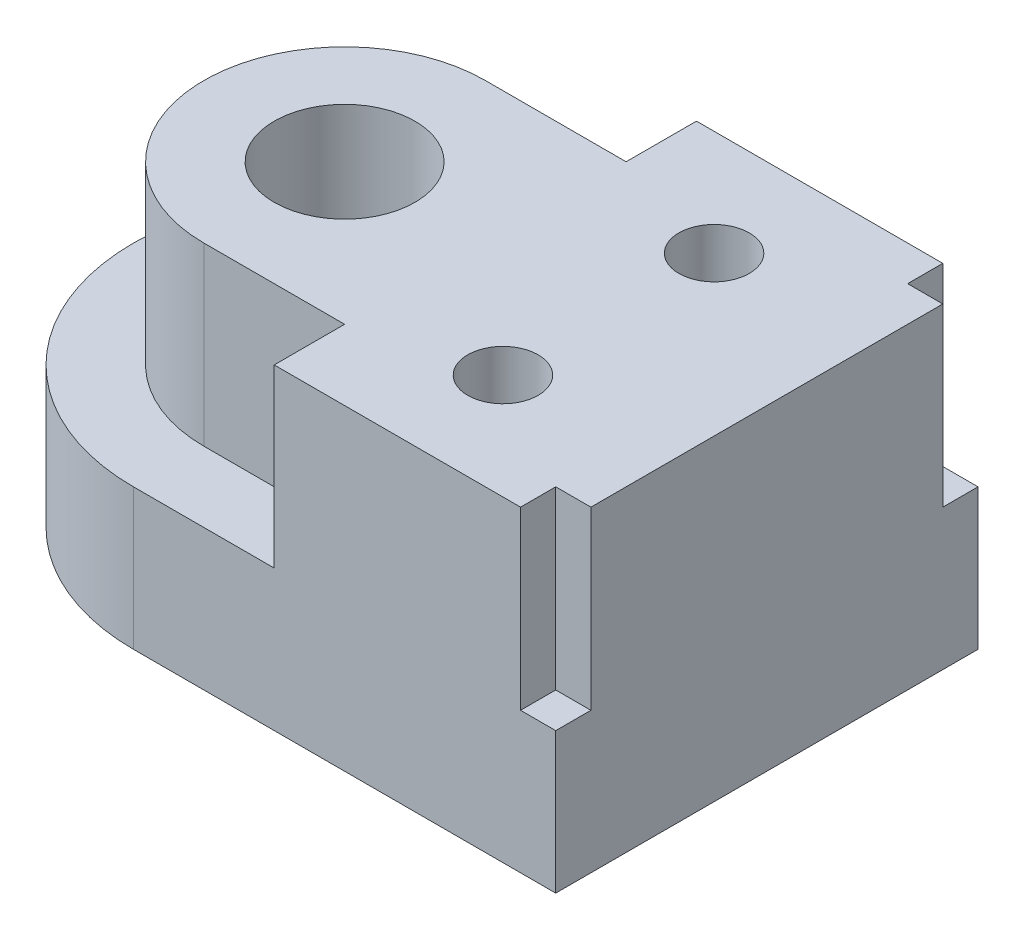
from build123d import *

# Parameters (mm, degrees)
BOSS_EXTRUDE2_DEPTH = 45
BOSS_EXTRUDE3_DEPTH = 20
SKETCH3_W           = 5
SKETCH3_H           = 5
CUT_EXTRUDE1_DEPTH  = 25
SKETCH4_R           = 10
SKETCH4_R_2         = 5
CUT_EXTRUDE2_DEPTH  = 81.777472107


with BuildPart() as part:
    # Sketch1 → Boss-Extrude2 (new body)
    with BuildSketch(Plane(origin=(0, 0, 0), x_dir=(1, 0, 0), z_dir=(0, 1, 0))):
        with BuildLine():
            Line((60, 30), (20, 30))
            Line((20, 30), (20, 20))
            Line((20, 20), (0, 20))
            ThreePointArc((0, 20), (-20, 0), (0, -20))
            Line((0, -20), (20, -20))
            Line((20, -20), (20, -30))
            Line((20, -30), (60, -30))
            Line((60, -30), (60, 30))
        make_face()
    extrude(amount=BOSS_EXTRUDE2_DEPTH)

    # Sketch1<3> → Boss-Extrude3 (add)
    with BuildSketch(Plane(origin=(0, 0, 0), x_dir=(1, 0, 0), z_dir=(0, 1, 0))):
        with BuildLine():
            Line((20, 30), (0, 30))
            ThreePointArc((0, 30), (-30, 0), (0, -30))
            Line((0, -30), (20, -30))
            Line((20, -30), (20, -20))
            Line((20, -20), (0, -20))
            ThreePointArc((0, -20), (-20, 0), (0, 20))
            Line((0, 20), (20, 20))
            Line((20, 20), (20, 30))
        make_face()
    extrude(amount=BOSS_EXTRUDE3_DEPTH)

    # Sketch3 → Cut-Extrude1 (cut)
    with BuildSketch(Plane(origin=(0, 45, 0), x_dir=(1, 0, 0), z_dir=(0, 1, 0))):
        with Locations((57.5, -27.5)):
            Rectangle(SKETCH3_W, SKETCH3_H)
        with Locations((57.5, 27.5)):
            Rectangle(SKETCH3_W, SKETCH3_H)
    extrude(amount=-CUT_EXTRUDE1_DEPTH, mode=Mode.SUBTRACT)

    # Sketch4 → Cut-Extrude2 (cut, through all)
    with BuildSketch(Plane(origin=(0, 45, 0), x_dir=(1, 0, 0), z_dir=(0, 1, 0))):
        Circle(SKETCH4_R)
        with Locations((37.5, 15)):
            Circle(SKETCH4_R_2)
        with Locations((37.5, -15)):
            Circle(SKETCH4_R_2)
    extrude(amount=-CUT_EXTRUDE2_DEPTH, mode=Mode.SUBTRACT)


solid = part.part
